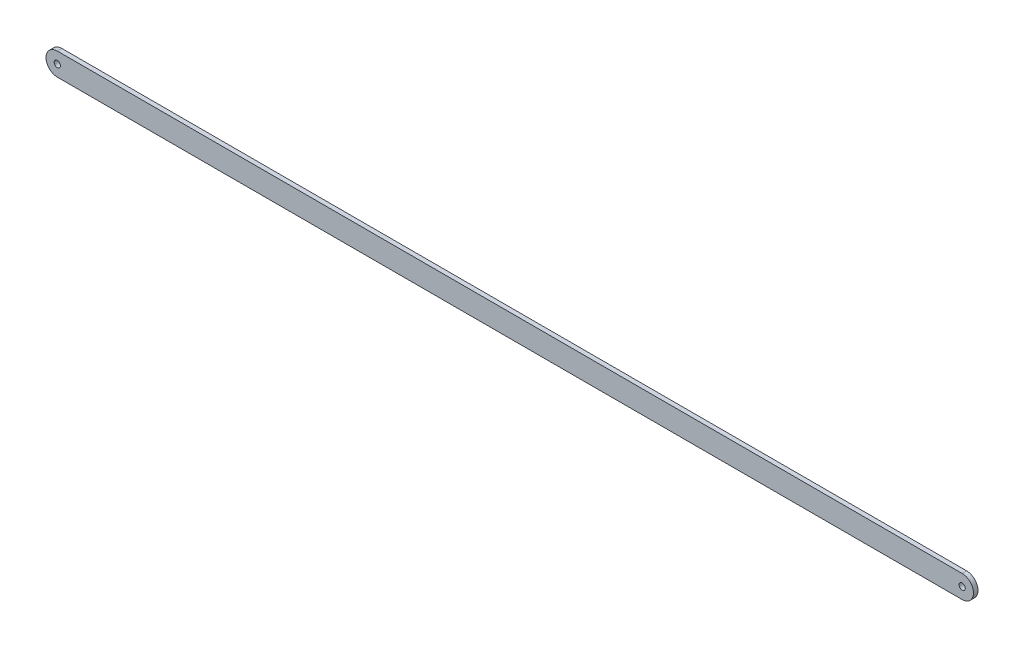
from build123d import *

# Parameters (mm, degrees)
SKETCH1_R           = 2.75
BOSS_EXTRUDE1_DEPTH = 4


with BuildPart() as part:
    # Sketch1 → Boss-Extrude1 (new body)
    with BuildSketch(Plane.XY):
        with BuildLine():
            Line((-400, -10), (400, -10))
            ThreePointArc((400, -10), (410, 0), (400, 10))
            Line((400, 10), (-400, 10))
            ThreePointArc((-400, 10), (-410, 0), (-400, -10))
        make_face()
        with Locations((-400, 0)):
            Circle(SKETCH1_R, mode=Mode.SUBTRACT)
        with Locations(Location((400, 0, 0), (0, 0, 180))):
            Circle(SKETCH1_R, mode=Mode.SUBTRACT)
    extrude(amount=BOSS_EXTRUDE1_DEPTH)


solid = part.part
